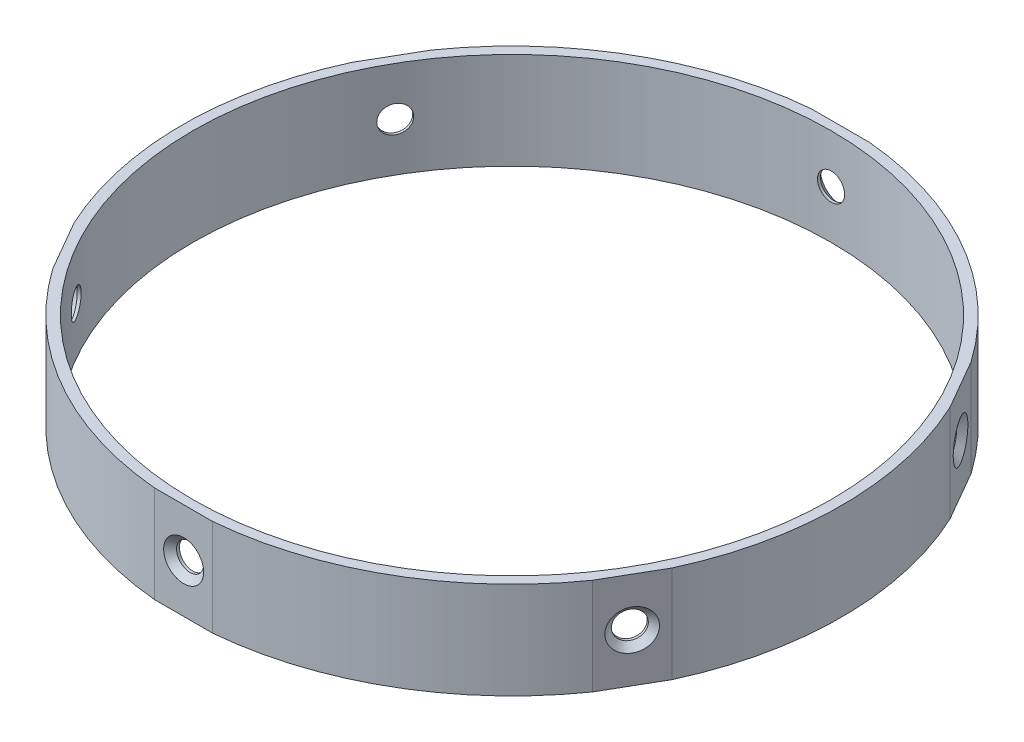
from build123d import *

# Parameters (mm, degrees)
SKETCH_2_R               = 51.1
SKETCH_2_R_2             = 49.5
EXTRUDE_1_DEPTH          = 15
SKETCH_3_R               = 2.1
CUT_EXTRUDE_1_DEPTH      = 60
CUT_EXTRUDE_START        = -15
CUT_EXTRUDE_2_DEPTH      = 15
PATTERN_CIRCULAR_4_COUNT = 6
PATTERN_CIRCULAR_5_COUNT = 6
CHAMFER_1_SIZE           = 1


with BuildPart() as part:
    # Эскиз2 → Бобышка-Вытянуть1 (new body)
    with BuildSketch(Plane(origin=(0, 0, 0), x_dir=(1, 0, 0), z_dir=(0, 1, 0))):
        with Locations(Location((0, 0, 0), (0, 0, 270))):
            Circle(SKETCH_2_R)
        with Locations(Location((0, 0, 0), (0, 0, 270))):
            Circle(SKETCH_2_R_2, mode=Mode.SUBTRACT)
    extrude(amount=EXTRUDE_1_DEPTH)

    # Эскиз3 → Вырез-Вытянуть1 (cut)
    with BuildSketch(Plane.XY):
        with Locations(Location((0, 7.5, 0), (0, 0, 90))):
            Circle(SKETCH_3_R)
    cut_extrude_1 = extrude(amount=-CUT_EXTRUDE_1_DEPTH, mode=Mode.SUBTRACT)

    # Эскиз5 → Вырез-Вытянуть2 (cut)
    with BuildSketch(Plane(origin=(0, 15, 0), x_dir=(1, 0, 0), z_dir=(0, 1, 0)).offset(CUT_EXTRUDE_START)):
        with BuildLine():
            Line((-4.5, -50.901473456), (4.5, -50.901473456))
            ThreePointArc((4.5, -50.901473456), (0, -51.1), (-4.5, -50.901473456))
        make_face()
    cut_extrude_2 = extrude(amount=CUT_EXTRUDE_2_DEPTH, mode=Mode.SUBTRACT)

    # Круговой массив4: Вырез-Вытянуть2 ×6 about axis
    pattern_circular_4_axis = Axis((0, 0, 0), (0, 1, 0))
    for i in range(1, PATTERN_CIRCULAR_4_COUNT):
        add(cut_extrude_2.rotate(pattern_circular_4_axis, i * 360 / PATTERN_CIRCULAR_4_COUNT), mode=Mode.SUBTRACT)

    # Круговой массив5: Вырез-Вытянуть1 ×6 about axis
    pattern_circular_5_axis = Axis((0, 15, 0), (0, 1, 0))
    for i in range(1, PATTERN_CIRCULAR_5_COUNT):
        add(cut_extrude_1.rotate(pattern_circular_5_axis, i * 360 / PATTERN_CIRCULAR_5_COUNT), mode=Mode.SUBTRACT)

    # Фаска1
    chamfer_1_edges = [part.edges().sort_by_distance(p)[0] for p in [
        (0, 5.4, -50.901473456),
        (0, 5.4, 50.901473456),
        (44.081969103, 5.4, 25.450736728),
        (44.081969103, 5.4, -25.450736728),
        (-44.081969103, 5.4, -25.450736728),
        (-44.081969103, 5.4, 25.450736728),
    ]]
    chamfer(chamfer_1_edges, length=CHAMFER_1_SIZE)


solid = part.part
